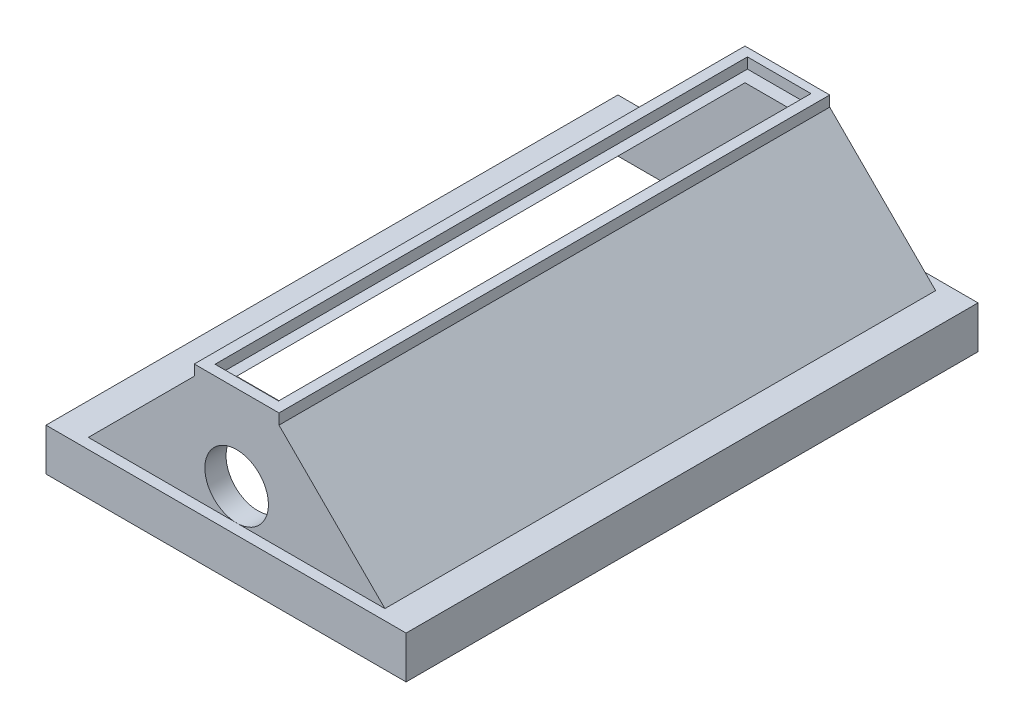
from build123d import *

# Parameters (mm, degrees)
SKETCH2_R            = 7.5
BOSS_EXTRUDE1_DEPTH  = 5
BOSS_EXTRUDE4_DEPTH  = 120
BOSS_EXTRUDE5_DEPTH  = 5
SKETCH7_W            = 85
SKETCH7_H            = 135
SKETCH7_W_2          = 70
SKETCH7_H_2          = 120
BOSS_EXTRUDE6_DEPTH  = 5
SKETCH10_W           = 85
SKETCH10_H           = 135
SKETCH10_W_2         = 80.1
SKETCH10_H_2         = 130.1
BOSS_EXTRUDE9_DEPTH  = 5
SKETCH11_W           = 20
SKETCH11_H           = 130
SKETCH11_W_2         = 15
SKETCH11_H_2         = 125.670447934
BOSS_EXTRUDE10_DEPTH = 2.5


with BuildPart() as part:
    # Sketch2 → Boss-Extrude1 (new body)
    with BuildSketch(Plane.XY):
        Polygon((-10, 17.5), (10, 17.5), (40, -12.5), (-40, -12.5), align=None)
        Circle(SKETCH2_R, mode=Mode.SUBTRACT)
    extrude(amount=BOSS_EXTRUDE1_DEPTH)

    # Sketch5 → Boss-Extrude4 (add)
    with BuildSketch(Plane(origin=(0, 0, 0), x_dir=(-1, 0, 0), z_dir=(0, 0, -1))):
        Polygon((-10, 17.5), (-40, -12.5), (-35, -12.5), (-5, 17.5), align=None)
        Polygon((10, 17.5), (40, -12.5), (35, -12.5), (5, 17.5), align=None)
    extrude(amount=BOSS_EXTRUDE4_DEPTH)

    # Sketch6 → Boss-Extrude5 (add)
    with BuildSketch(Plane(origin=(0, 0, -120), x_dir=(-1, 0, 0), z_dir=(0, 0, -1))):
        Polygon((-40, -12.5), (40, -12.5), (10, 17.5), (-10, 17.5), align=None)
    extrude(amount=BOSS_EXTRUDE5_DEPTH)

    # Sketch7 → Boss-Extrude6 (add)
    with BuildSketch(Plane(origin=(0, -12.5, 0), x_dir=(-1, 0, 0), z_dir=(0, -1, 0))):
        with Locations((0, 60)):
            Rectangle(SKETCH7_W, SKETCH7_H)
        with Locations((0, 60)):
            Rectangle(SKETCH7_W_2, SKETCH7_H_2, mode=Mode.SUBTRACT)
    extrude(amount=-BOSS_EXTRUDE6_DEPTH)

    # Sketch10 → Boss-Extrude9 (add)
    with BuildSketch(Plane(origin=(0, -12.5, 0), x_dir=(-1, 0, 0), z_dir=(0, -1, 0))):
        with Locations((0, 60)):
            Rectangle(SKETCH10_W, SKETCH10_H)
        with Locations((0, 60)):
            Rectangle(SKETCH10_W_2, SKETCH10_H_2, mode=Mode.SUBTRACT)
    extrude(amount=BOSS_EXTRUDE9_DEPTH)

    # Sketch11 → Boss-Extrude10 (add)
    with BuildSketch(Plane(origin=(0, 17.5, 0), x_dir=(1, 0, 0), z_dir=(0, 1, 0))):
        with Locations((0, 60)):
            Rectangle(SKETCH11_W, SKETCH11_H)
        with Locations((0, 60.23315482)):
            Rectangle(SKETCH11_W_2, SKETCH11_H_2, mode=Mode.SUBTRACT)
    extrude(amount=BOSS_EXTRUDE10_DEPTH)


solid = part.part
